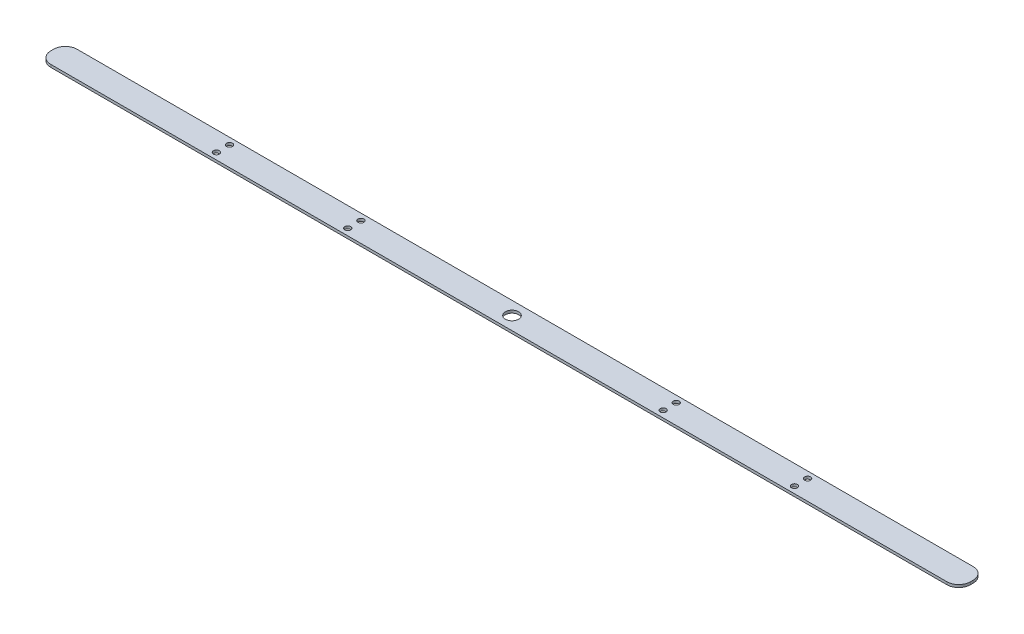
from build123d import *

# Parameters (mm, degrees)
SKETCH1_W           = 700
SKETCH1_H           = 20
BOSS_EXTRUDE1_DEPTH = 2
FILLET1_R           = 9
SKETCH2_R           = 5
SKETCH2_R_2         = 2.25
CUT_EXTRUDE1_DEPTH  = 701.288511972


with BuildPart() as part:
    # Sketch1 → Boss-Extrude1 (new body)
    with BuildSketch(Plane(origin=(0, 0, 0), x_dir=(1, 0, 0), z_dir=(0, 1, 0))):
        with Locations((350, 10)):
            Rectangle(SKETCH1_W, SKETCH1_H)
    extrude(amount=BOSS_EXTRUDE1_DEPTH)

    # Fillet1
    fillet1_edges = [part.edges().sort_by_distance(p)[0] for p in [
        (0, 1, -20),
        (700, 1, -20),
        (700, 1, 0),
        (0, 1, 0),
    ]]
    fillet(fillet1_edges, radius=FILLET1_R)

    # Sketch2 → Cut-Extrude1 (cut, through all)
    with BuildSketch(Plane(origin=(0, 2, 0), x_dir=(1, 0, 0), z_dir=(0, 1, 0))):
        with Locations(Location((350, 10, 0), (0, 0, 270))):
            Circle(SKETCH2_R)
        with Locations(Location((130, 15, 0), (0, 0, 270))):
            Circle(SKETCH2_R_2)
        with Locations(Location((230, 15, 0), (0, 0, 270))):
            Circle(SKETCH2_R_2)
        with Locations(Location((130, 5, 0), (0, 0, 270))):
            Circle(SKETCH2_R_2)
        with Locations(Location((230, 5, 0), (0, 0, 270))):
            Circle(SKETCH2_R_2)
        with Locations(Location((470, 15, 0), (0, 0, 90))):
            Circle(SKETCH2_R_2)
        with Locations(Location((470, 5, 0), (0, 0, 90))):
            Circle(SKETCH2_R_2)
        with Locations(Location((570, 5, 0), (0, 0, 90))):
            Circle(SKETCH2_R_2)
        with Locations(Location((570, 15, 0), (0, 0, 90))):
            Circle(SKETCH2_R_2)
    extrude(amount=-CUT_EXTRUDE1_DEPTH, mode=Mode.SUBTRACT)


solid = part.part
